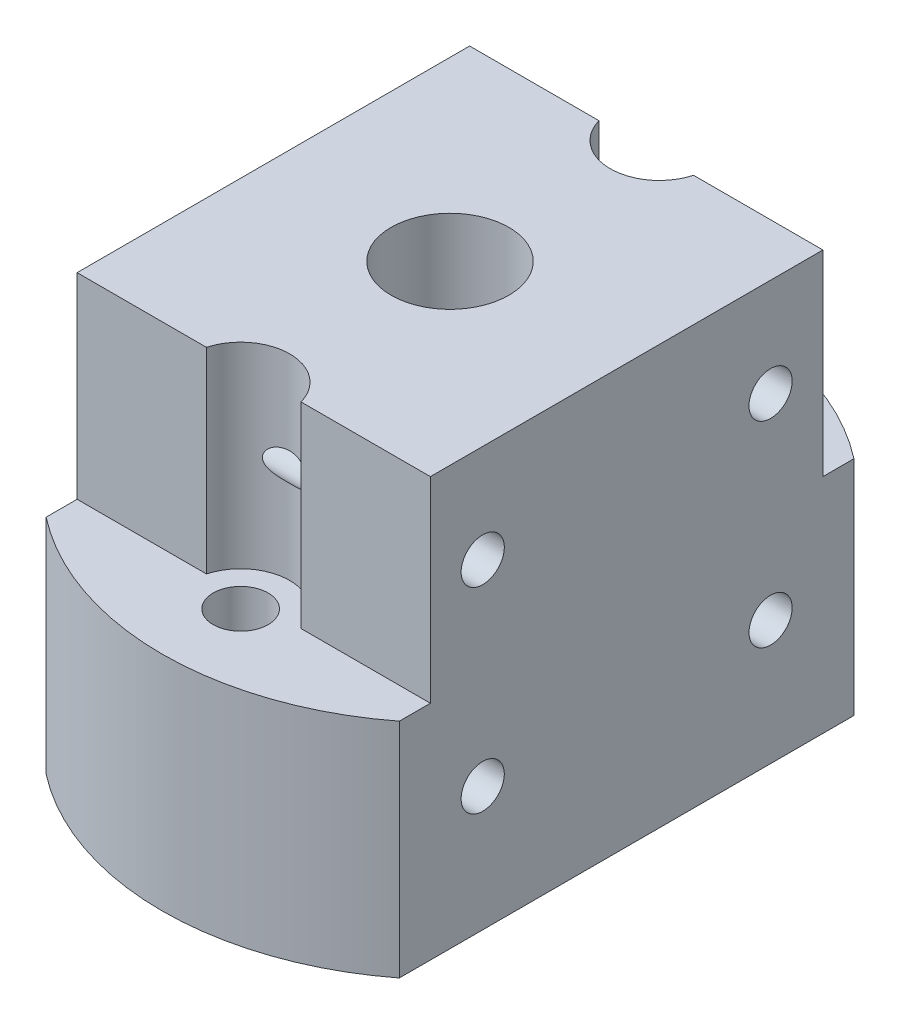
from build123d import *

# Parameters (mm, degrees)
SKETCH_1_R          = 2.1
SKETCH_1_R_2        = 8.15
EXTRUDE_1_DEPTH     = 17
SKETCH_2_W          = 27
SKETCH_2_H          = 30
EXTRUDE_2_DEPTH     = 15
SKETCH_3_R          = 3.75
CUT_EXTRUDE_2_DEPTH = 15
SKETCH_4_R          = 1.65
CUT_EXTRUDE_3_DEPTH = 48.296934362
SKETCH_5_R          = 4.5
CUT_EXTRUDE_4_DEPTH = 42.112650154


with BuildPart() as part:
    # 草图1 → 凸台-拉伸1 (new body)
    with BuildSketch(Plane(origin=(0, 0, 0), x_dir=(1, 0, 0), z_dir=(0, 1, 0))):
        with BuildLine():
            Line((-13.5, -17.370952766), (-13.5, 17.370952766))
            ThreePointArc((-13.5, 17.370952766), (0, 22), (13.5, 17.370952766))
            Line((13.5, 17.370952766), (13.5, -17.370952766))
            ThreePointArc((13.5, -17.370952766), (0, -22), (-13.5, -17.370952766))
        make_face()
        with Locations(Location((0, 16, 0), (0, 0, 270))):
            Circle(SKETCH_1_R, mode=Mode.SUBTRACT)
        with Locations(Location((0, -16, 0), (0, 0, 270))):
            Circle(SKETCH_1_R, mode=Mode.SUBTRACT)
        with Locations(Location((0, 0, 0), (0, 0, 270))):
            Circle(SKETCH_1_R_2, mode=Mode.SUBTRACT)
    extrude(amount=EXTRUDE_1_DEPTH)

    # 草图2 → 凸台-拉伸2 (add)
    with BuildSketch(Plane(origin=(0, 17, 0), x_dir=(1, 0, 0), z_dir=(0, 1, 0))):
        Rectangle(SKETCH_2_W, SKETCH_2_H)
    extrude(amount=EXTRUDE_2_DEPTH)

    # 草图3 → 切除-拉伸2 (cut)
    with BuildSketch(Plane(origin=(0, 32, 0), x_dir=(1, 0, 0), z_dir=(0, 1, 0))):
        with Locations((0, 16)):
            Circle(SKETCH_3_R)
        with Locations((0, -16)):
            Circle(SKETCH_3_R)
    extrude(amount=-CUT_EXTRUDE_2_DEPTH, mode=Mode.SUBTRACT)

    # 草图4 → 切除-拉伸3 (cut, through all)
    with BuildSketch(Plane.ZY.offset(13.5)):
        with Locations((11, 24.5)):
            Circle(SKETCH_4_R)
        with Locations(Location((-11, 24.5, 0), (0, 0, 180))):
            Circle(SKETCH_4_R)
        with Locations((11, 9.5)):
            Circle(SKETCH_4_R)
        with Locations(Location((-11, 9.5, 0), (0, 0, 180))):
            Circle(SKETCH_4_R)
    extrude(amount=-CUT_EXTRUDE_3_DEPTH, mode=Mode.SUBTRACT)

    # 草图5 → 切除-拉伸4 (cut, through all)
    with BuildSketch(Plane(origin=(0, 32, 0), x_dir=(1, 0, 0), z_dir=(0, 1, 0))):
        with Locations(Location((0, 0, 0), (0, 0, 270))):
            Circle(SKETCH_5_R)
    extrude(amount=-CUT_EXTRUDE_4_DEPTH, mode=Mode.SUBTRACT)


solid = part.part
